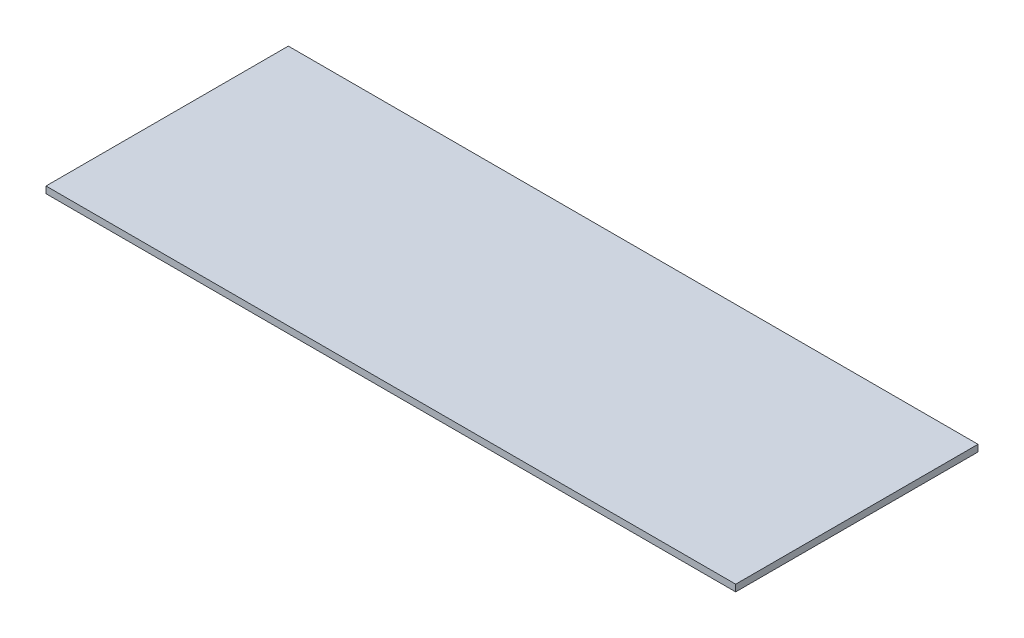
from build123d import *

# Parameters (mm, degrees)
SKIZZE1_W                       = 1850
SKIZZE1_H                       = 650
AUFSATZ_LINEAR_AUSTRAGEN1_DEPTH = 18


with BuildPart() as part:
    # Skizze1 → Aufsatz-Linear austragen1 (new body)
    with BuildSketch(Plane(origin=(0, 0, 0), x_dir=(1, 0, 0), z_dir=(0, 1, 0))):
        with Locations((925, 325)):
            Rectangle(SKIZZE1_W, SKIZZE1_H)
    extrude(amount=AUFSATZ_LINEAR_AUSTRAGEN1_DEPTH)


solid = part.part
